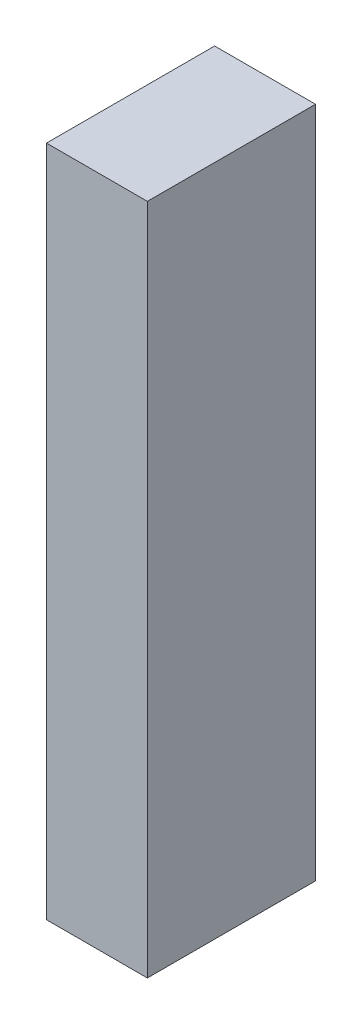
from build123d import *

# Parameters (mm, degrees)
SKETCH1_W           = 3
SKETCH1_H           = 5
BOSS_EXTRUDE1_DEPTH = 20


with BuildPart() as part:
    # Sketch1 → Boss-Extrude1 (new body)
    with BuildSketch(Plane(origin=(0, 0, 0), x_dir=(1, 0, 0), z_dir=(0, 1, 0))):
        Rectangle(SKETCH1_W, SKETCH1_H)
    extrude(amount=BOSS_EXTRUDE1_DEPTH)


solid = part.part
